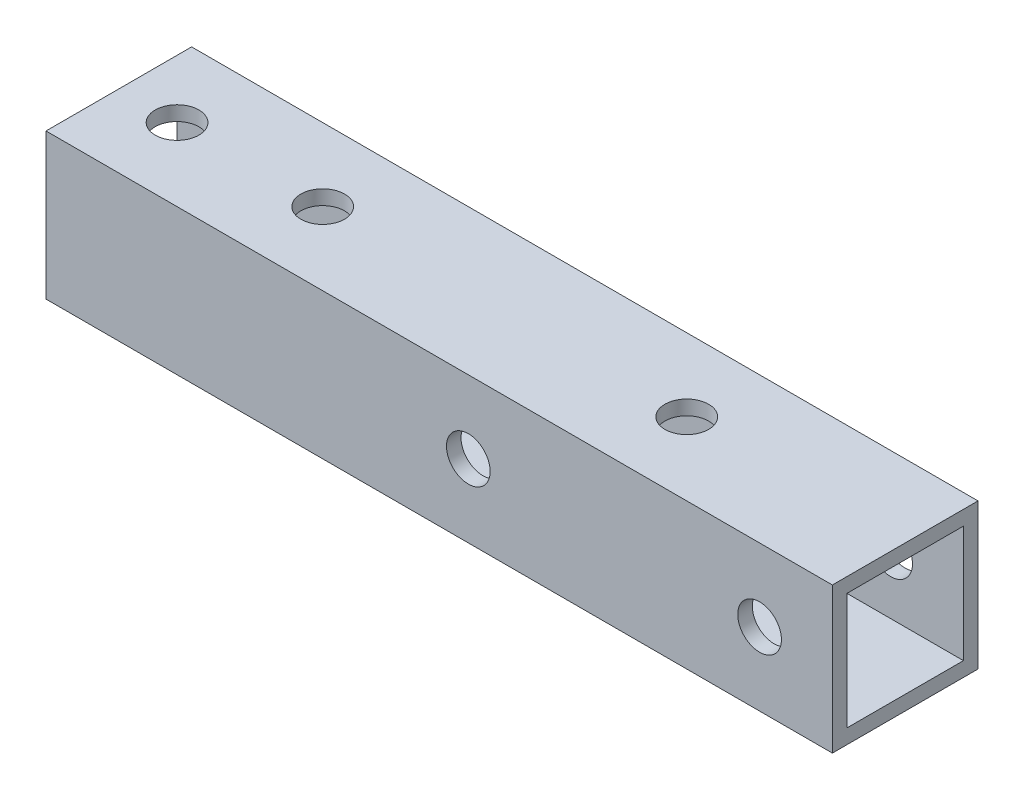
from build123d import *

# Parameters (mm, degrees)
SKETCH_1_W          = 10
SKETCH_1_H          = 10
SKETCH_1_W_2        = 8
SKETCH_1_H_2        = 8
EXTRUDE_1_DEPTH     = 54
SKETCH_2_R          = 1.5
CUT_EXTRUDE_1_DEPTH = 56.145262716
SKETCH_3_R          = 1.5
CUT_EXTRUDE_2_DEPTH = 56.145262716


with BuildPart() as part:
    # ｽｹｯﾁ1 → 押し出し-薄板1 (new body)
    with BuildSketch(Plane(origin=(0, 0, 0), x_dir=(0, 0, -1), z_dir=(1, 0, 0))):
        Rectangle(SKETCH_1_W, SKETCH_1_H)
        Rectangle(SKETCH_1_W_2, SKETCH_1_H_2, mode=Mode.SUBTRACT)
    extrude(amount=EXTRUDE_1_DEPTH)

    # ｽｹｯﾁ2 → ｶｯﾄ - 押し出し1 (cut, through all)
    with BuildSketch(Plane(origin=(0, 5, 0), x_dir=(1, 0, 0), z_dir=(0, 1, 0))):
        with Locations(Location((4, 0, 0), (0, 0, 270))):
            Circle(SKETCH_2_R)
        with Locations(Location((14, 0, 0), (0, 0, 270))):
            Circle(SKETCH_2_R)
        with Locations(Location((39, 0, 0), (0, 0, 270))):
            Circle(SKETCH_2_R)
    extrude(amount=-CUT_EXTRUDE_1_DEPTH, mode=Mode.SUBTRACT)

    # ｽｹｯﾁ3 → ｶｯﾄ - 押し出し2 (cut, through all)
    with BuildSketch(Plane.XY.offset(5)):
        with Locations((49, 0)):
            Circle(SKETCH_3_R)
        with Locations((29, 0)):
            Circle(SKETCH_3_R)
    extrude(amount=-CUT_EXTRUDE_2_DEPTH, mode=Mode.SUBTRACT)


solid = part.part
